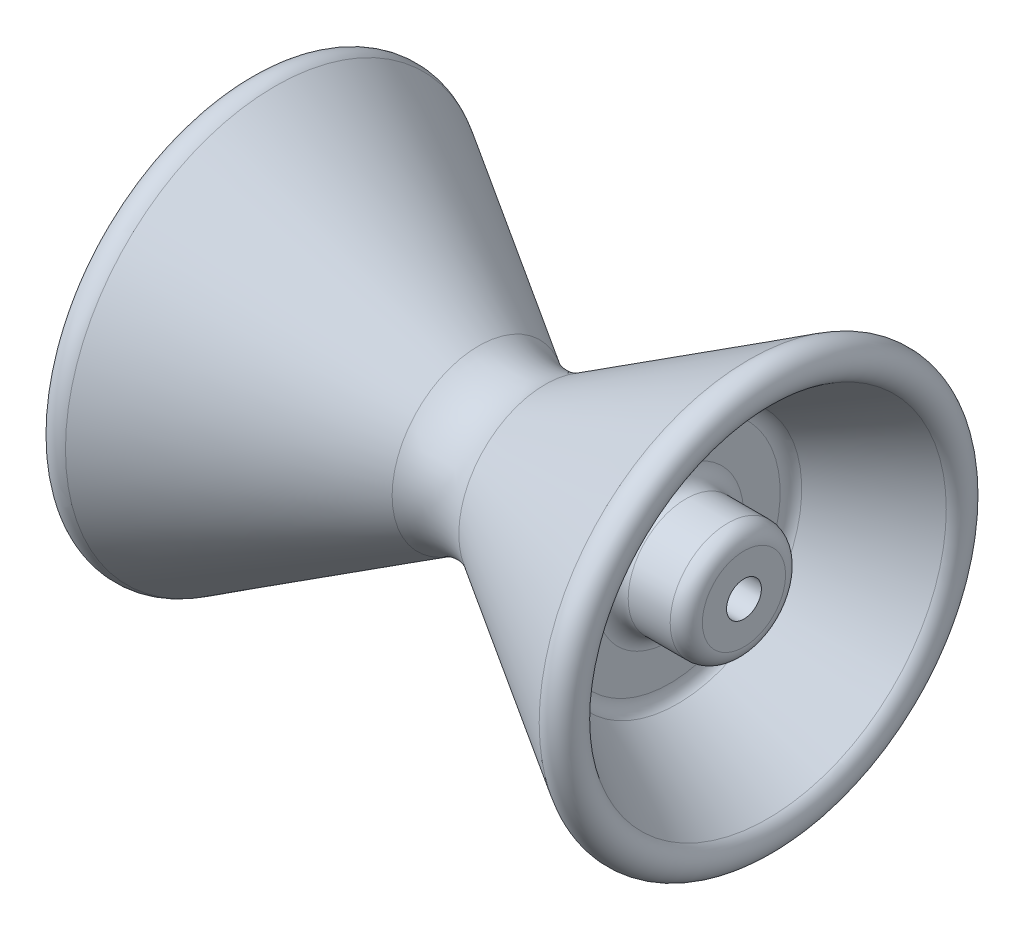
from build123d import *


with BuildPart() as part:
    # Sketch1 → Revolve-Thin4 (revolve)
    with BuildSketch(Plane.XY, mode=Mode.PRIVATE) as revolve_thin4_sk:
        with BuildLine():
            Line((317.500749376, 181.481182294), (205.631875504, 113.795346764))
            ThreePointArc((205.631875504, 113.795346764), (198.563002816, 106.505443866), (195.985211682, 96.683700731))
            Line((195.985211682, 96.683700731), (195.985211682, 51.196146352))
            ThreePointArc((195.985211682, 51.196146352), (201.843076058, 37.054010728), (215.985211682, 31.196146352))
            Line((215.985211682, 31.196146352), (268.140064564, 31.196146352))
            ThreePointArc((268.140064564, 31.196146352), (282.282200188, 25.338281976), (288.140064564, 11.196146352))
            Line((288.140064564, 11.196146352), (288.140064564, -18.803853648))
            Line((288.140064564, -18.803853648), (145.985211682, -18.803853648))
            Line((145.985211682, -18.803853648), (145.985211682, 42.229543941))
            ThreePointArc((145.985211682, 42.229543941), (135.806954818, 59.651752808), (115.631875504, 59.341189975))
            Line((115.631875504, 59.341189975), (58.434393332, 24.734071507))
            ThreePointArc((58.434393332, 24.734071507), (30.326276952, 12.122342811), (0, 6.696586332))
            ThreePointArc((0, 6.696586332), (-30.326276952, 12.122342811), (-58.434393332, 24.734071507))
            Line((-58.434393332, 24.734071507), (-115.631875504, 59.341189975))
            ThreePointArc((-115.631875504, 59.341189975), (-135.806954818, 59.651752808), (-145.985211682, 42.229543941))
            Line((-145.985211682, 42.229543941), (-145.985211682, -18.803853648))
            Line((-145.985211682, -18.803853648), (-288.140064564, -18.803853648))
            Line((-288.140064564, -18.803853648), (-288.140064564, 11.196146352))
            ThreePointArc((-288.140064564, 11.196146352), (-282.282200188, 25.338281976), (-268.140064564, 31.196146352))
            Line((-268.140064564, 31.196146352), (-215.985211682, 31.196146352))
            ThreePointArc((-215.985211682, 31.196146352), (-201.843076058, 37.054010728), (-195.985211682, 51.196146352))
            Line((-195.985211682, 51.196146352), (-195.985211682, 96.683700731))
            ThreePointArc((-195.985211682, 96.683700731), (-198.563002816, 106.505443866), (-205.631875504, 113.795346764))
            Line((-205.631875504, 113.795346764), (-317.500749376, 181.481182294))
            ThreePointArc((-317.500749376, 181.481182294), (-325.103846521, 212.379289668), (-294.205738205, 219.982382983))
            Line((-294.205738205, 219.982382983), (-41.413344713, 67.031309313))
            ThreePointArc((-41.413344713, 67.031309313), (0, 55.477893448), (41.413344713, 67.031309313))
            Line((41.413344713, 67.031309313), (294.205738222, 219.982382994))
            ThreePointArc((294.205738222, 219.982382994), (325.103846526, 212.379289659), (317.500749376, 181.481182294))
        make_face()
        with BuildLine():
            Line((312.324081287, 190.037005311), (200.455207415, 122.351169781))
            ThreePointArc((200.455207415, 122.351169781), (189.851898383, 111.416315434), (185.985211682, 96.683700731))
            Line((185.985211682, 96.683700731), (185.985211682, 51.196146352))
            ThreePointArc((185.985211682, 51.196146352), (194.772008247, 29.982942916), (215.985211682, 21.196146352))
            Line((215.985211682, 21.196146352), (268.140064564, 21.196146352))
            ThreePointArc((268.140064564, 21.196146352), (275.211132376, 18.267214164), (278.140064564, 11.196146352))
            Line((278.140064564, 11.196146352), (278.140064564, -8.803853648))
            Line((278.140064564, -8.803853648), (155.985211682, -8.803853648))
            Line((155.985211682, -8.803853648), (155.985211682, 42.229543941))
            ThreePointArc((155.985211682, 42.229543941), (140.717826385, 68.362857241), (110.455207415, 67.897012992))
            Line((110.455207415, 67.897012992), (53.257725243, 33.289894524))
            ThreePointArc((53.257725243, 33.289894524), (27.638236871, 21.758514292), (0, 16.712845147))
            ThreePointArc((0, 16.712845147), (-27.638236871, 21.758514292), (-53.257725243, 33.289894524))
            Line((-53.257725243, 33.289894524), (-110.455207415, 67.897012992))
            ThreePointArc((-110.455207415, 67.897012992), (-140.717826385, 68.362857241), (-155.985211682, 42.229543941))
            Line((-155.985211682, 42.229543941), (-155.985211682, -8.803853648))
            Line((-155.985211682, -8.803853648), (-278.140064564, -8.803853648))
            Line((-278.140064564, -8.803853648), (-278.140064564, 11.196146352))
            ThreePointArc((-278.140064564, 11.196146352), (-275.211132376, 18.267214164), (-268.140064564, 21.196146352))
            Line((-268.140064564, 21.196146352), (-215.985211682, 21.196146352))
            ThreePointArc((-215.985211682, 21.196146352), (-194.772008247, 29.982942916), (-185.985211682, 51.196146352))
            Line((-185.985211682, 51.196146352), (-185.985211682, 96.683700731))
            ThreePointArc((-185.985211682, 96.683700731), (-189.851898383, 111.416315434), (-200.455207415, 122.351169781))
            Line((-200.455207415, 122.351169781), (-312.324081287, 190.037005311))
            ThreePointArc((-312.324081287, 190.037005311), (-316.548024349, 207.202620182), (-299.382409087, 211.426561656))
            Line((-299.382409087, 211.426561656), (-46.590012802, 58.475486296))
            ThreePointArc((-46.590012802, 58.475486296), (0, 45.477893448), (46.590012802, 58.475486296))
            Line((46.590012802, 58.475486296), (299.382409087, 211.426561656))
            ThreePointArc((299.382409087, 211.426561656), (316.548024349, 207.202620182), (312.324081287, 190.037005311))
        make_face(mode=Mode.SUBTRACT)
    revolve(revolve_thin4_sk.sketch.rotate(Axis((-361.480146336, -40.443726197, 0), (1, 0, 0)), 90), axis=Axis((-361.480146336, -40.443726197, 0), (1, 0, 0)))


solid = part.part
